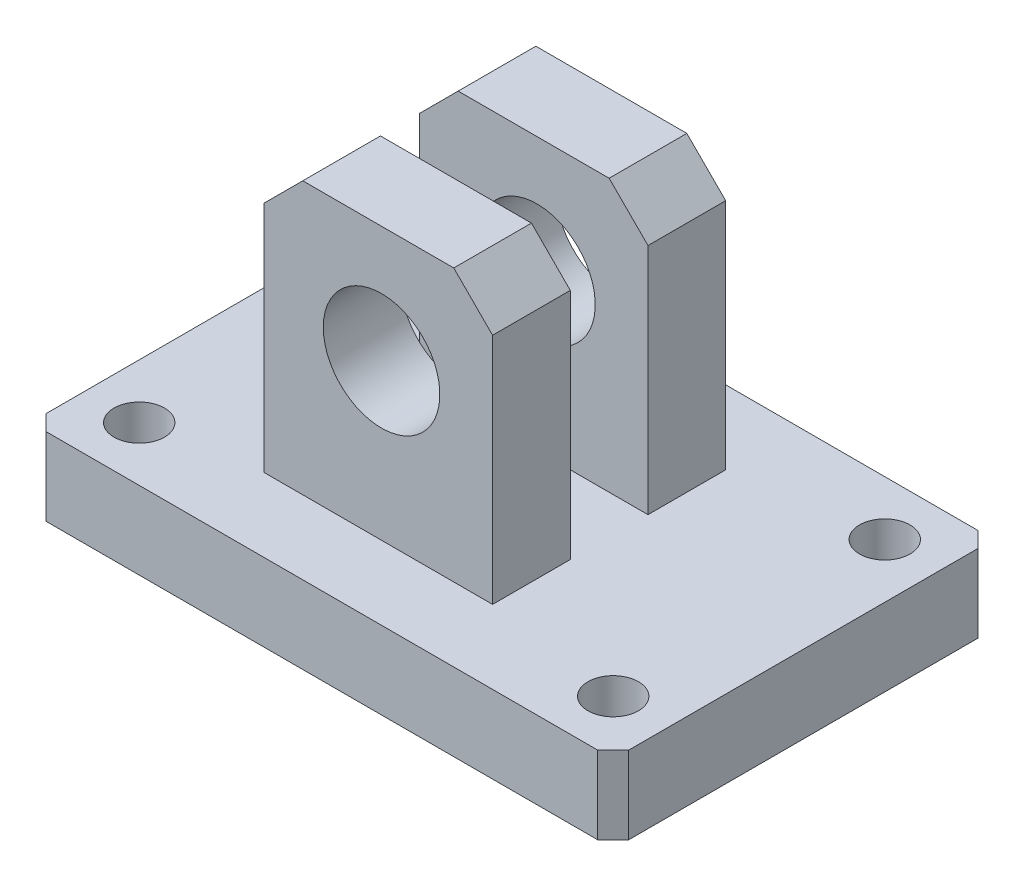
from build123d import *

# Parameters (mm, degrees)
SKETCH1_R           = 3.25
BOSS_EXTRUDE1_DEPTH = 10
SKETCH2_W           = 29.431964563
SKETCH2_H           = 10
BOSS_EXTRUDE2_DEPTH = 35
SKETCH3_R           = 7.5
CUT_EXTRUDE1_DEPTH  = 35
CHAMFER1_SIZE       = 5


with BuildPart() as part:
    # Sketch1 → Boss-Extrude1 (new body)
    with BuildSketch(Plane(origin=(0, 0, 0), x_dir=(1, 0, 0), z_dir=(0, 1, 0))):
        Polygon((-37.5, -22.474596659), (-37.5, 22.474596659), (-35.5, 24.474596659), (35.5, 24.474596659), (37.5, 22.474596659), (37.5, -22.474596659), (35.5, -24.474596659), (-35.5, -24.474596659), align=None)
        with Locations(Location((-30.5, 17.474596659, 0), (0, 0, 270))):
            Circle(SKETCH1_R, mode=Mode.SUBTRACT)
        with Locations(Location((30.5, 17.474596659, 0), (0, 0, 270))):
            Circle(SKETCH1_R, mode=Mode.SUBTRACT)
        with Locations(Location((30.5, -17.474596659, 0), (0, 0, 90))):
            Circle(SKETCH1_R, mode=Mode.SUBTRACT)
        with Locations(Location((-30.5, -17.474596659, 0), (0, 0, 90))):
            Circle(SKETCH1_R, mode=Mode.SUBTRACT)
    extrude(amount=BOSS_EXTRUDE1_DEPTH)

    # Sketch2 → Boss-Extrude2 (add)
    with BuildSketch(Plane(origin=(0, 10, 0), x_dir=(1, 0, 0), z_dir=(0, 1, 0))):
        with Locations((-2.213221609, -10)):
            Rectangle(SKETCH2_W, SKETCH2_H)
        with Locations((-2.213221609, 10)):
            Rectangle(SKETCH2_W, SKETCH2_H)
    extrude(amount=BOSS_EXTRUDE2_DEPTH)

    # Sketch3 → Cut-Extrude1 (cut)
    with BuildSketch(Plane(origin=(0, 0, -15), x_dir=(-1, 0, 0), z_dir=(0, 0, -1))):
        with Locations((1.786108667, 30)):
            Circle(SKETCH3_R)
    extrude(amount=-CUT_EXTRUDE1_DEPTH, mode=Mode.SUBTRACT)

    # Chamfer1
    chamfer1_edges = [part.edges().sort_by_distance(p)[0] for p in [
        (-16.929203891, 45, -10),
        (12.502760672, 45, -10),
        (12.502760672, 45, 10),
        (-16.929203891, 45, 10),
    ]]
    chamfer(chamfer1_edges, length=CHAMFER1_SIZE)


solid = part.part
